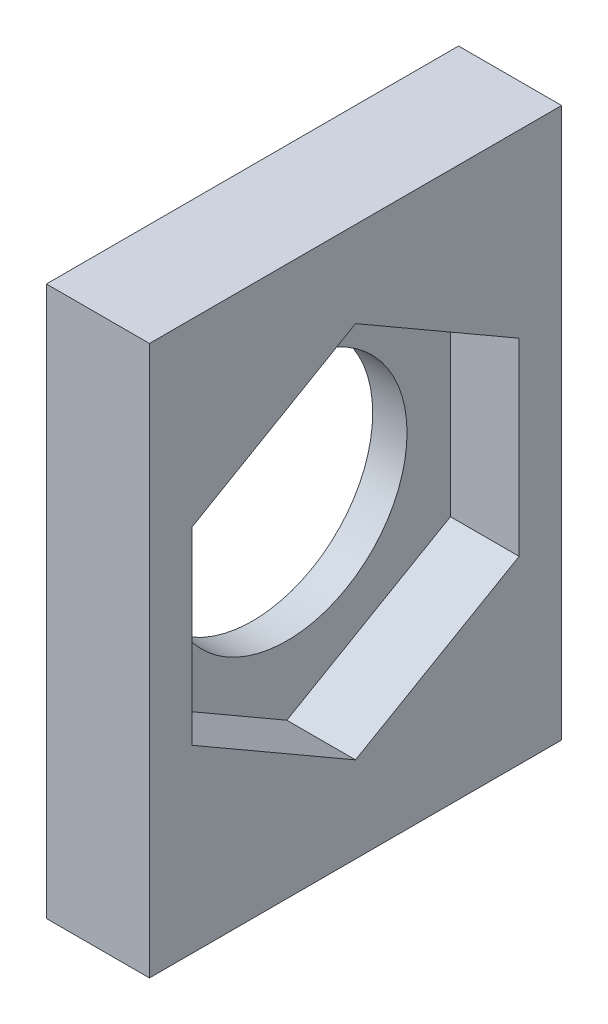
from build123d import *

# Parameters (mm, degrees)
SKETCH1_W           = 12
SKETCH1_H           = 12
BOSS_EXTRUDE1_DEPTH = 3
SKETCH2_R           = 3.5
CUT_EXTRUDE1_DEPTH  = 3
CUT_EXTRUDE2_DEPTH  = 2
SKETCH4_W           = 3
SKETCH4_H           = 12
BOSS_EXTRUDE2_DEPTH = 2
SKETCH5_W           = 3
SKETCH5_H           = 12
BOSS_EXTRUDE3_DEPTH = 2


with BuildPart() as part:
    # Sketch1 → Boss-Extrude1 (new body)
    with BuildSketch(Plane(origin=(0, 0, 0), x_dir=(0, 0, -1), z_dir=(1, 0, 0))):
        with Locations((6, 6)):
            Rectangle(SKETCH1_W, SKETCH1_H)
    extrude(amount=BOSS_EXTRUDE1_DEPTH)

    # Sketch2 → Cut-Extrude1 (cut)
    with BuildSketch(Plane(origin=(3, 0, 0), x_dir=(0, 0, -1), z_dir=(1, 0, 0))):
        with Locations((6, 6)):
            Circle(SKETCH2_R)
    extrude(amount=-CUT_EXTRUDE1_DEPTH, mode=Mode.SUBTRACT)

    # Sketch3 → Cut-Extrude2 (cut)
    with BuildSketch(Plane(origin=(3, 0, 0), x_dir=(0, 0, -1), z_dir=(1, 0, 0))):
        Polygon((6, 11.5), (1.236860279, 8.75), (1.236860279, 3.25), (6, 0.5), (10.763139721, 3.25), (10.763139721, 8.75), align=None)
    extrude(amount=-CUT_EXTRUDE2_DEPTH, mode=Mode.SUBTRACT)

    # Sketch4 → Boss-Extrude2 (add)
    with BuildSketch(Plane(origin=(0, 12, 0), x_dir=(1, 0, 0), z_dir=(0, 1, 0))):
        with Locations((1.5, 6)):
            Rectangle(SKETCH4_W, SKETCH4_H)
    extrude(amount=BOSS_EXTRUDE2_DEPTH)

    # Sketch5 → Boss-Extrude3 (add)
    with BuildSketch(Plane.XZ):
        with Locations((1.5, -6)):
            Rectangle(SKETCH5_W, SKETCH5_H)
    extrude(amount=BOSS_EXTRUDE3_DEPTH)


solid = part.part
